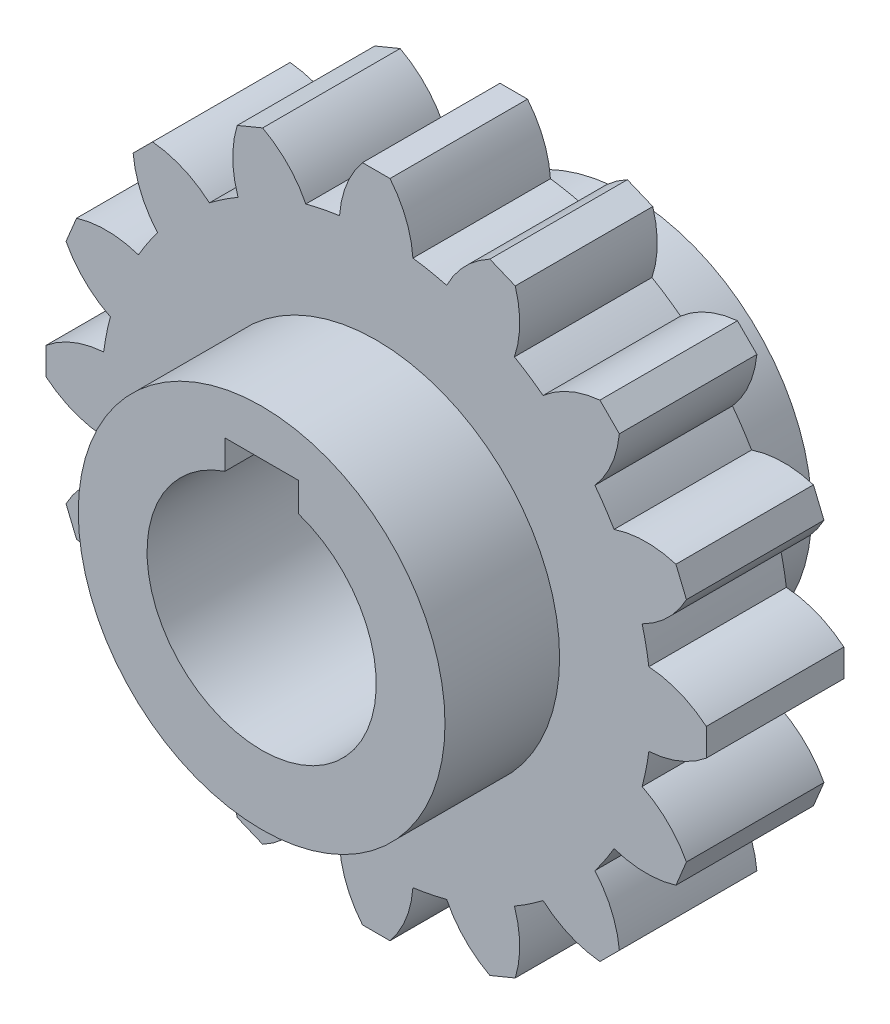
from build123d import *

# Parameters (mm, degrees)
BOSS_EXTRUDE1_DEPTH = 7.5
SKETCH2_R           = 20
BOSS_EXTRUDE2_DEPTH = 20
CUT_EXTRUDE1_DEPTH  = 65.745656225


with BuildPart() as part:
    # Sketch1 → Boss-Extrude1 (new, symmetric)
    with BuildSketch(Plane.XY):
        with BuildLine():
            Line((-1.5, 36), (1.5, 36))
            ThreePointArc((1.5, 36), (3.242504384, 33.062509074), (4, 29.732137495))
            ThreePointArc((4, 29.732137495), (5.85270966, 29.423558412), (7.682478298, 28.999647019))
            ThreePointArc((7.682478298, 28.999647019), (9.656791021, 31.786628134), (12.390784266, 33.833688319))
            Line((12.390784266, 33.833688319), (15.162422864, 32.685638022))
            ThreePointArc((15.162422864, 32.685638022), (15.64815789, 29.30492272), (15.073514558, 25.93817956))
            ThreePointArc((15.073514558, 25.93817956), (16.667106991, 24.944088369), (18.195368917, 23.852223166))
            ThreePointArc((18.195368917, 23.852223166), (21.085927531, 25.671521208), (24.395183951, 26.516504294))
            Line((24.395183951, 26.516504294), (26.516504294, 24.395183951))
            ThreePointArc((26.516504294, 24.395183951), (25.671521208, 21.085927531), (23.852223166, 18.195368917))
            ThreePointArc((23.852223166, 18.195368917), (24.944088369, 16.667106991), (25.93817956, 15.073514558))
            ThreePointArc((25.93817956, 15.073514558), (29.30492272, 15.64815789), (32.685638022, 15.162422864))
            Line((32.685638022, 15.162422864), (33.833688319, 12.390784266))
            ThreePointArc((33.833688319, 12.390784266), (31.786628134, 9.656791021), (28.999647019, 7.682478298))
            ThreePointArc((28.999647019, 7.682478298), (29.423558412, 5.85270966), (29.732137495, 4))
            ThreePointArc((29.732137495, 4), (33.062509074, 3.242504384), (36, 1.5))
            Line((36, 1.5), (36, -1.5))
            ThreePointArc((36, -1.5), (33.062509074, -3.242504384), (29.732137495, -4))
            ThreePointArc((29.732137495, -4), (29.423558412, -5.85270966), (28.999647019, -7.682478298))
            ThreePointArc((28.999647019, -7.682478298), (31.786628134, -9.656791021), (33.833688319, -12.390784266))
            Line((33.833688319, -12.390784266), (32.685638022, -15.162422864))
            ThreePointArc((32.685638022, -15.162422864), (29.30492272, -15.64815789), (25.93817956, -15.073514558))
            ThreePointArc((25.93817956, -15.073514558), (24.944088369, -16.667106991), (23.852223166, -18.195368917))
            ThreePointArc((23.852223166, -18.195368917), (25.671521208, -21.085927531), (26.516504294, -24.395183951))
            Line((26.516504294, -24.395183951), (24.395183951, -26.516504294))
            ThreePointArc((24.395183951, -26.516504294), (21.085927531, -25.671521208), (18.195368917, -23.852223166))
            ThreePointArc((18.195368917, -23.852223166), (16.667106991, -24.944088369), (15.073514558, -25.93817956))
            ThreePointArc((15.073514558, -25.93817956), (15.64815789, -29.30492272), (15.162422864, -32.685638022))
            Line((15.162422864, -32.685638022), (12.390784266, -33.833688319))
            ThreePointArc((12.390784266, -33.833688319), (9.656791021, -31.786628134), (7.682478298, -28.999647019))
            ThreePointArc((7.682478298, -28.999647019), (5.85270966, -29.423558412), (4, -29.732137495))
            ThreePointArc((4, -29.732137495), (3.242504384, -33.062509074), (1.5, -36))
            Line((1.5, -36), (-1.5, -36))
            ThreePointArc((-1.5, -36), (-3.242504384, -33.062509074), (-4, -29.732137495))
            ThreePointArc((-4, -29.732137495), (-5.85270966, -29.423558412), (-7.682478298, -28.999647019))
            ThreePointArc((-7.682478298, -28.999647019), (-9.656791021, -31.786628134), (-12.390784266, -33.833688319))
            Line((-12.390784266, -33.833688319), (-15.162422864, -32.685638022))
            ThreePointArc((-15.162422864, -32.685638022), (-15.64815789, -29.30492272), (-15.073514558, -25.93817956))
            ThreePointArc((-15.073514558, -25.93817956), (-16.667106991, -24.944088369), (-18.195368917, -23.852223166))
            ThreePointArc((-18.195368917, -23.852223166), (-21.085927531, -25.671521208), (-24.395183951, -26.516504294))
            Line((-24.395183951, -26.516504294), (-26.516504294, -24.395183951))
            ThreePointArc((-26.516504294, -24.395183951), (-25.671521208, -21.085927531), (-23.852223166, -18.195368917))
            ThreePointArc((-23.852223166, -18.195368917), (-24.944088369, -16.667106991), (-25.93817956, -15.073514558))
            ThreePointArc((-25.93817956, -15.073514558), (-29.30492272, -15.64815789), (-32.685638022, -15.162422864))
            Line((-32.685638022, -15.162422864), (-33.833688319, -12.390784266))
            ThreePointArc((-33.833688319, -12.390784266), (-31.786628134, -9.656791021), (-28.999647019, -7.682478298))
            ThreePointArc((-28.999647019, -7.682478298), (-29.423558412, -5.85270966), (-29.732137495, -4))
            ThreePointArc((-29.732137495, -4), (-33.062509074, -3.242504384), (-36, -1.5))
            Line((-36, -1.5), (-36, 1.5))
            ThreePointArc((-36, 1.5), (-33.062509074, 3.242504384), (-29.732137495, 4))
            ThreePointArc((-29.732137495, 4), (-29.423558412, 5.85270966), (-28.999647019, 7.682478298))
            ThreePointArc((-28.999647019, 7.682478298), (-31.786628134, 9.656791021), (-33.833688319, 12.390784266))
            Line((-33.833688319, 12.390784266), (-32.685638022, 15.162422864))
            ThreePointArc((-32.685638022, 15.162422864), (-29.30492272, 15.64815789), (-25.93817956, 15.073514558))
            ThreePointArc((-25.93817956, 15.073514558), (-24.944088369, 16.667106991), (-23.852223166, 18.195368917))
            ThreePointArc((-23.852223166, 18.195368917), (-25.671521208, 21.085927531), (-26.516504294, 24.395183951))
            Line((-26.516504294, 24.395183951), (-24.395183951, 26.516504294))
            ThreePointArc((-24.395183951, 26.516504294), (-21.085927531, 25.671521208), (-18.195368917, 23.852223166))
            ThreePointArc((-18.195368917, 23.852223166), (-16.667106991, 24.944088369), (-15.073514558, 25.93817956))
            ThreePointArc((-15.073514558, 25.93817956), (-15.64815789, 29.30492272), (-15.162422864, 32.685638022))
            Line((-15.162422864, 32.685638022), (-12.390784266, 33.833688319))
            ThreePointArc((-12.390784266, 33.833688319), (-9.656791021, 31.786628134), (-7.682478298, 28.999647019))
            ThreePointArc((-7.682478298, 28.999647019), (-5.85270966, 29.423558412), (-4, 29.732137495))
            ThreePointArc((-4, 29.732137495), (-3.242504384, 33.062509074), (-1.5, 36))
        make_face()
    extrude(amount=BOSS_EXTRUDE1_DEPTH, both=True)

    # Sketch2 → Boss-Extrude2 (add, symmetric)
    with BuildSketch(Plane.XY):
        with Locations(Location((0, 0, 0), (0, 0, 180))):
            Circle(SKETCH2_R)
    extrude(amount=BOSS_EXTRUDE2_DEPTH, both=True)

    # Sketch3 → Cut-Extrude1 (cut, through all)
    with BuildSketch(Plane.XY.offset(20)):
        with BuildLine():
            Line((-4, 11.842719282), (-4, 15))
            Line((-4, 15), (4, 15))
            Line((4, 15), (4, 11.842719282))
            ThreePointArc((4, 11.842719282), (0, -12.5), (-4, 11.842719282))
        make_face()
    extrude(amount=-CUT_EXTRUDE1_DEPTH, mode=Mode.SUBTRACT)


solid = part.part
